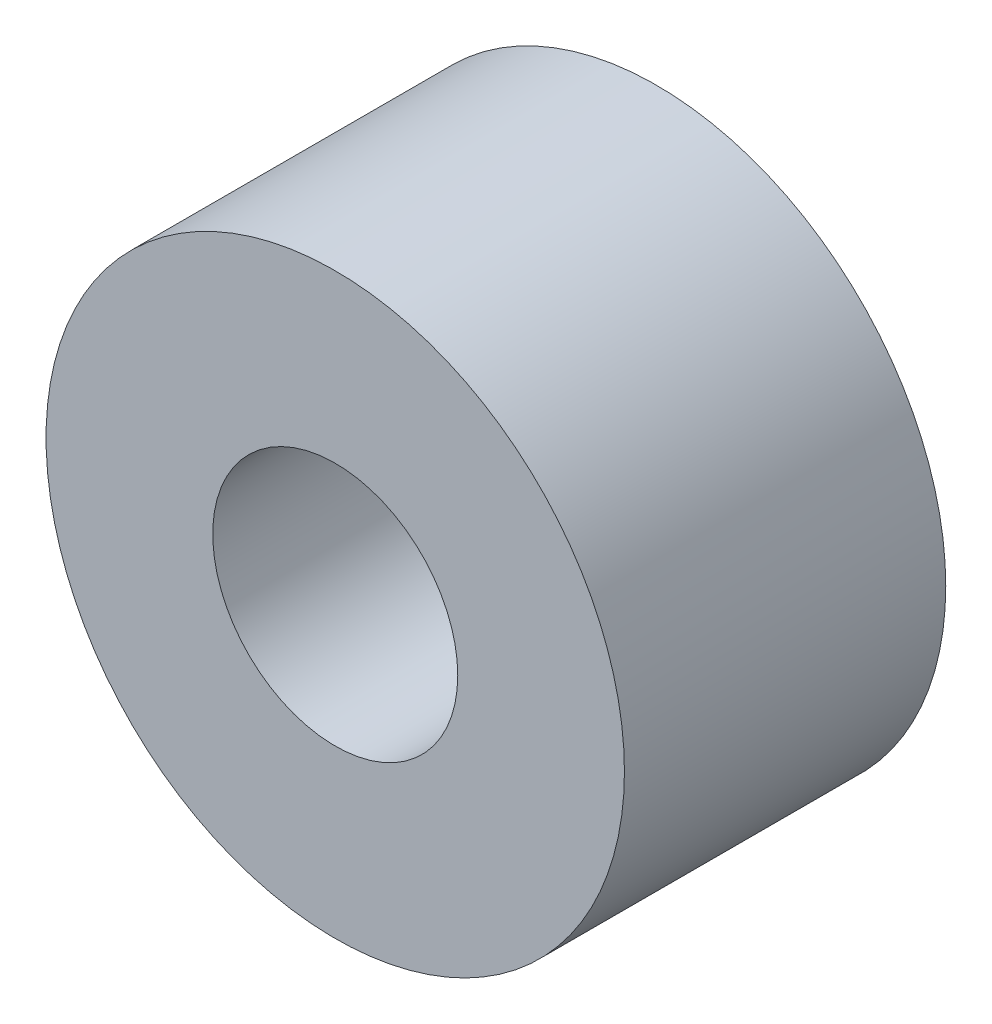
from build123d import *

# Parameters (mm, degrees)
SKETCH_1_R      = 3.6
SKETCH_1_R_2    = 1.525
EXTRUDE_1_DEPTH = 4


with BuildPart() as part:
    # 草图1 → 凸台-拉伸1 (new body)
    with BuildSketch(Plane.XY):
        Circle(SKETCH_1_R)
        Circle(SKETCH_1_R_2, mode=Mode.SUBTRACT)
    extrude(amount=EXTRUDE_1_DEPTH)


solid = part.part
